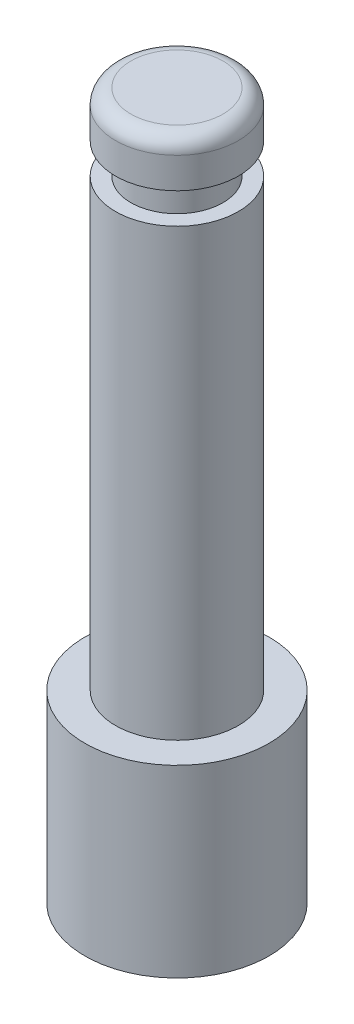
from build123d import *


with BuildPart() as part:
    # Esquisse1 → Révolution1 (revolve)
    with BuildSketch(Plane.XY, mode=Mode.PRIVATE) as r_volution1_sk:
        with BuildLine():
            Line((0, 0), (1.5, 0))
            Line((1.5, 0), (1.5, 3))
            Line((1.5, 3), (1, 3))
            Line((1, 3), (1, 10.25))
            Line((1, 10.25), (0.75, 10.25))
            Line((0.75, 10.25), (0.75, 10.75))
            Line((0.75, 10.75), (1, 10.75))
            Line((1, 10.75), (1, 11.25))
            ThreePointArc((1, 11.25), (0.926776695, 11.426776695), (0.75, 11.5))
            Line((0.75, 11.5), (0, 11.5))
            Line((0, 11.5), (0, 0))
        make_face()
    revolve(r_volution1_sk.sketch.rotate(Axis((0, 0, 0), (0, 1, 0)), 90), axis=Axis((0, 0, 0), (0, 1, 0)))


solid = part.part
